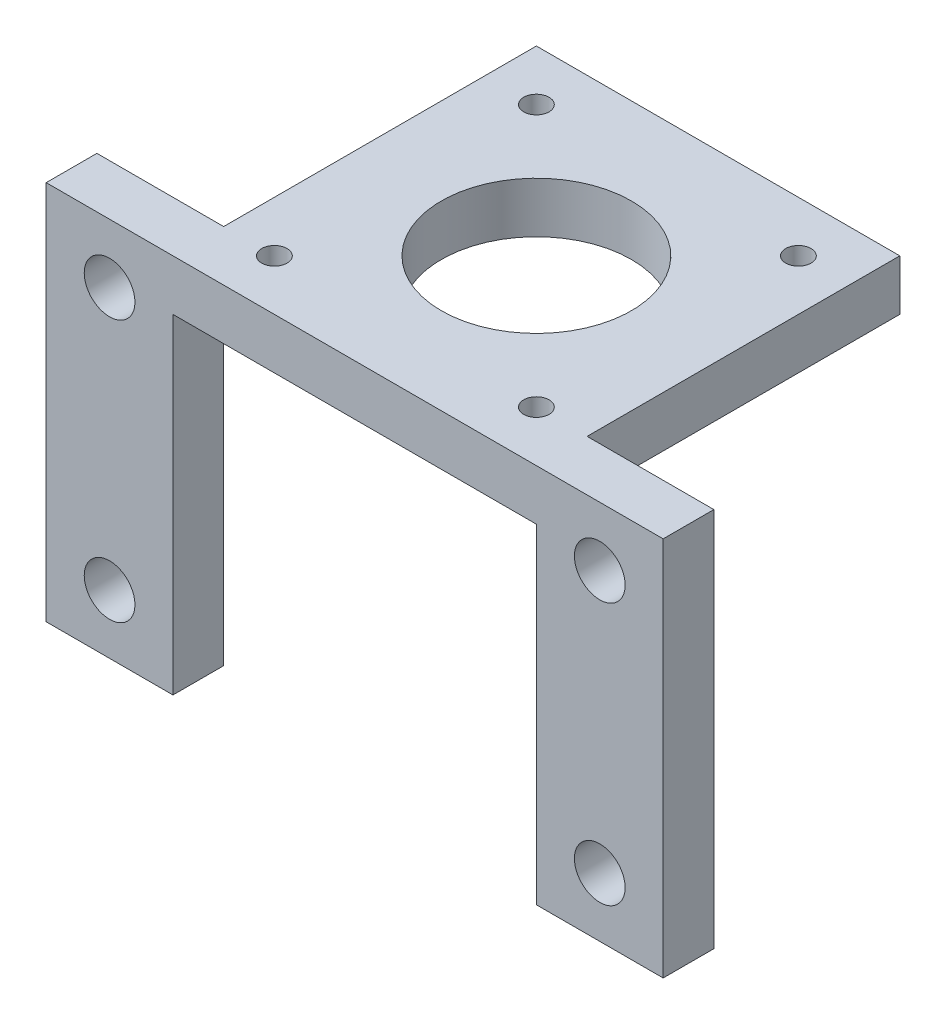
from build123d import *

# Parameters (mm, degrees)
CROQUIS1_W              = 43
CROQUIS1_H              = 43
CROQUIS1_R              = 1.5
CROQUIS1_R_2            = 11.25
SALIENTE_EXTRUIR1_DEPTH = 6
CROQUIS2_W              = 15
CROQUIS2_H              = 6
SALIENTE_EXTRUIR2_DEPTH = 45
CROQUIS3_R              = 3
CORTAR_EXTRUIR1_DEPTH   = 45


with BuildPart() as part:
    # Croquis1 → Saliente-Extruir1 (new body)
    with BuildSketch(Plane(origin=(0, 0, 0), x_dir=(1, 0, 0), z_dir=(0, 1, 0))):
        Rectangle(CROQUIS1_W, CROQUIS1_H)
        with Locations(Location((-15.5, 15.5, 0), (0, 0, 270))):
            Circle(CROQUIS1_R, mode=Mode.SUBTRACT)
        with Locations(Location((15.5, 15.5, 0), (0, 0, 270))):
            Circle(CROQUIS1_R, mode=Mode.SUBTRACT)
        with Locations(Location((-15.5, -15.5, 0), (0, 0, 270))):
            Circle(CROQUIS1_R, mode=Mode.SUBTRACT)
        with Locations(Location((15.5, -15.5, 0), (0, 0, 270))):
            Circle(CROQUIS1_R, mode=Mode.SUBTRACT)
        with Locations(Location((0, 0, 0), (0, 0, 270))):
            Circle(CROQUIS1_R_2, mode=Mode.SUBTRACT)
    extrude(amount=SALIENTE_EXTRUIR1_DEPTH)

    # Croquis2 → Saliente-Extruir2 (add)
    with BuildSketch(Plane(origin=(0, 6, 0), x_dir=(1, 0, 0), z_dir=(0, 1, 0))):
        with Locations((-29, -18.5)):
            Rectangle(CROQUIS2_W, CROQUIS2_H)
        with Locations((29, -18.5)):
            Rectangle(CROQUIS2_W, CROQUIS2_H)
    extrude(amount=-SALIENTE_EXTRUIR2_DEPTH)

    # Croquis3 → Cortar-Extruir1 (cut)
    with BuildSketch(Plane(origin=(0, 0, 15.5), x_dir=(-1, 0, 0), z_dir=(0, 0, -1))):
        with Locations((-29, -32)):
            Circle(CROQUIS3_R)
        with Locations((-29, -1)):
            Circle(CROQUIS3_R)
        with Locations((29, -1)):
            Circle(CROQUIS3_R)
        with Locations((29, -32)):
            Circle(CROQUIS3_R)
    extrude(amount=-CORTAR_EXTRUIR1_DEPTH, mode=Mode.SUBTRACT)


solid = part.part
